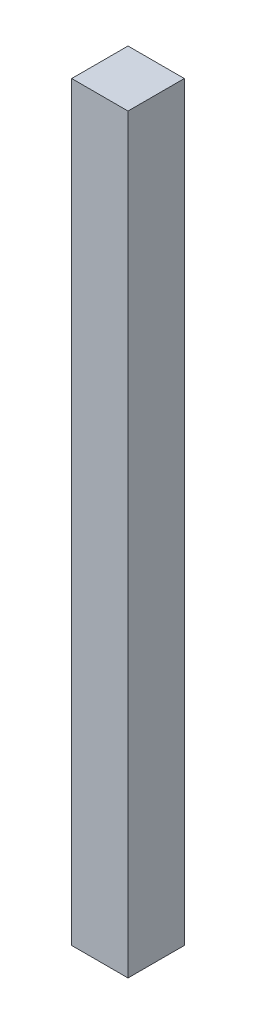
from build123d import *

# Parameters (mm, degrees)
CROQUIS1_W              = 30
CROQUIS1_H              = 30
SALIENTE_EXTRUIR1_DEPTH = 400


with BuildPart() as part:
    # Croquis1 → Saliente-Extruir1 (new body)
    with BuildSketch(Plane(origin=(0, 0, 0), x_dir=(1, 0, 0), z_dir=(0, 1, 0))):
        Rectangle(CROQUIS1_W, CROQUIS1_H)
    extrude(amount=SALIENTE_EXTRUIR1_DEPTH)


solid = part.part
